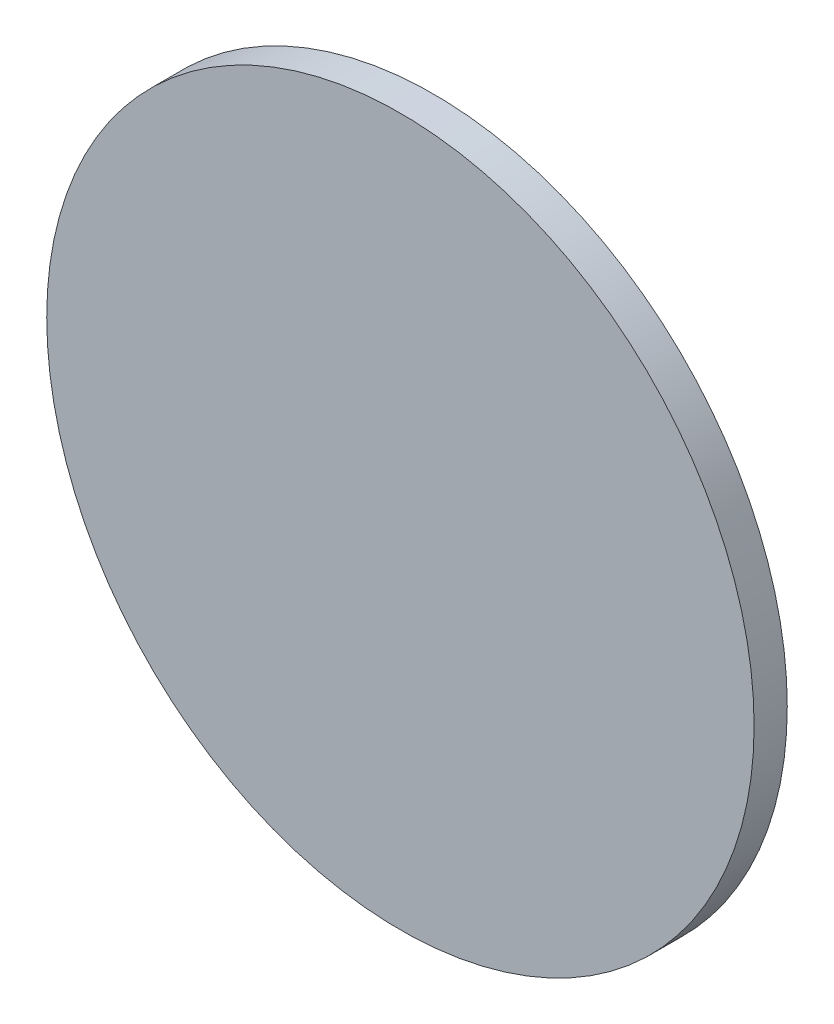
from build123d import *

# Parameters (mm, degrees)
SKETCH_2_R      = 16
EXTRUDE_1_DEPTH = 1.5


with BuildPart() as part:
    # 草图2 → 凸台-拉伸1 (new body)
    with BuildSketch(Plane.XY):
        Circle(SKETCH_2_R)
    extrude(amount=EXTRUDE_1_DEPTH)


solid = part.part
